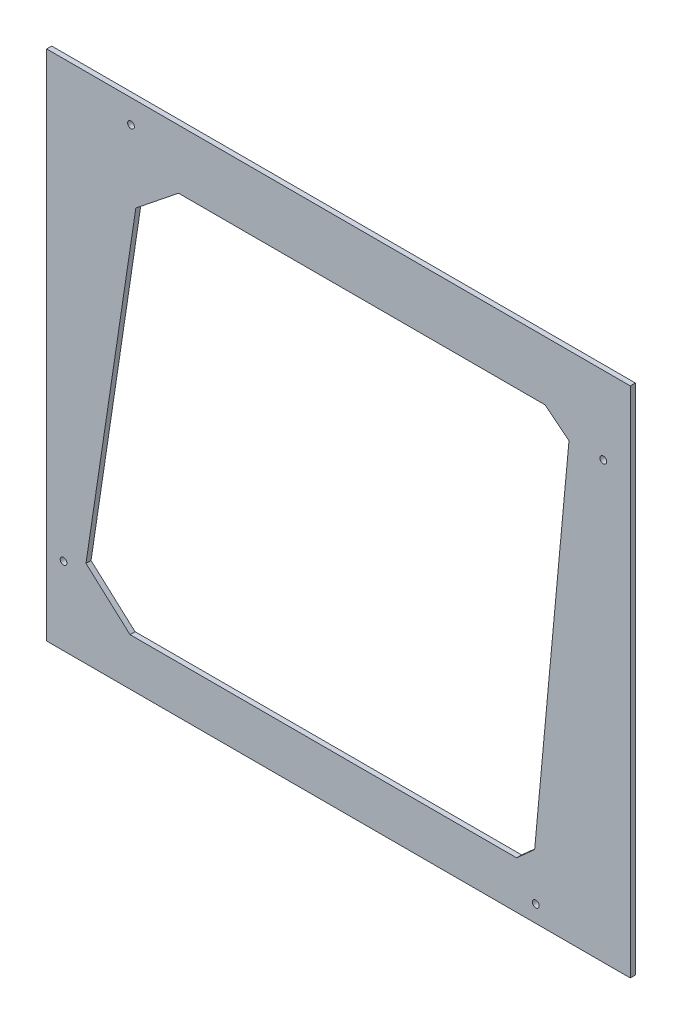
from build123d import *

# Parameters (mm, degrees)
SKETCH1_W           = 346
SKETCH1_H           = 304
SKETCH1_R           = 2
BOSS_EXTRUDE1_DEPTH = 3


with BuildPart() as part:
    # Sketch1 → Boss-Extrude1 (new body)
    with BuildSketch(Plane.XY):
        with Locations((3, 0)):
            Rectangle(SKETCH1_W, SKETCH1_H)
        with Locations((-160, -106)):
            Circle(SKETCH1_R, mode=Mode.SUBTRACT)
        with Locations((120, -142)):
            Circle(SKETCH1_R, mode=Mode.SUBTRACT)
        Polygon((139.655171099, 105.627740104), (119.302480143, -114.375157373), (108.608210557, -124), (-120.566987488, -124), (-146.683245886, -100.495367441), (-117.140423658, 96.746416259), (-91.823443982, 117), (125.439846228, 117), align=None, mode=Mode.SUBTRACT)
        with Locations((-120, 138)):
            Circle(SKETCH1_R, mode=Mode.SUBTRACT)
        with Locations((160, 106)):
            Circle(SKETCH1_R, mode=Mode.SUBTRACT)
    extrude(amount=BOSS_EXTRUDE1_DEPTH)


solid = part.part
